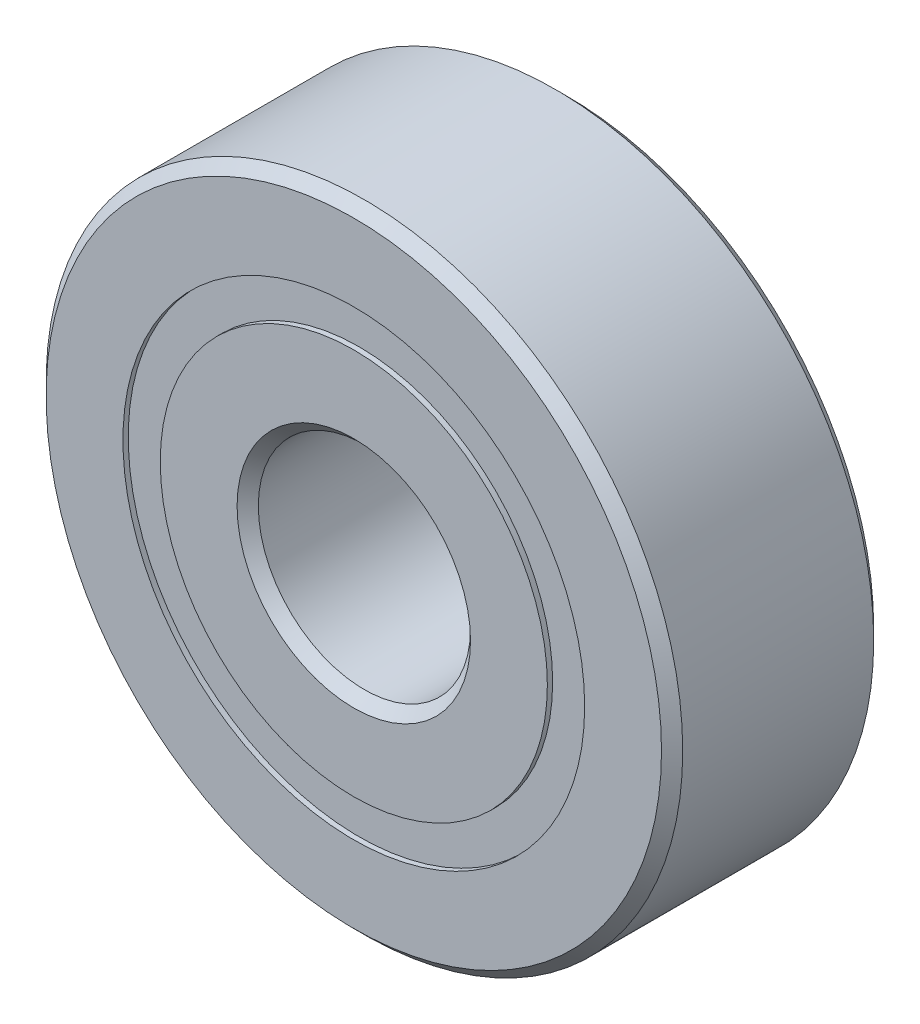
from build123d import *

# Parameters (mm, degrees)
CIRPATTERN1_COUNT = 12
SKETCH5_W         = 0.944081583
SKETCH5_H         = 0.703296704


with BuildPart() as part:
    # Sketch1 → Revolve1 (revolve)
    with BuildSketch(Plane(origin=(0, 0, 0), x_dir=(0, 0, -1), z_dir=(1, 0, 0))):
        with BuildLine():
            Line((1.8, 6), (-1.8, 6))
            Line((-1.8, 6), (-2, 5.8))
            Line((-2, 5.8), (-2, 4.351648352))
            Line((-2, 4.351648352), (-0.888888889, 4.351648352))
            ThreePointArc((-0.888888889, 4.351648352), (0, 4.955918417), (0.888888889, 4.351648352))
            Line((0.888888889, 4.351648352), (2, 4.351648352))
            Line((2, 4.351648352), (2, 5.8))
            Line((2, 5.8), (1.8, 6))
        make_face()
    revolve(axis=Axis((0, 0, 2), (0, 0, -1)))


with BuildPart() as body_2:
    # Sketch3 → Revolve3 (revolve)
    with BuildSketch(Plane(origin=(0, 0, 0), x_dir=(0, 0, -1), z_dir=(1, 0, 0))):
        with BuildLine():
            Line((-2, 3.648351648), (-0.888888889, 3.648351648))
            ThreePointArc((-0.888888889, 3.648351648), (0, 3.044081583), (0.888888889, 3.648351648))
            Line((0.888888889, 3.648351648), (2, 3.648351648))
            Line((2, 3.648351648), (2, 2.2))
            Line((2, 2.2), (1.8, 2))
            Line((1.8, 2), (-1.8, 2))
            Line((-1.8, 2), (-2, 2.2))
            Line((-2, 2.2), (-2, 3.648351648))
        make_face()
    revolve(axis=Axis((0, 0, 2), (0, 0, -1)))


with BuildPart() as body_3:
    # Sketch4 → Revolve4 (revolve)
    with BuildSketch(Plane(origin=(0, 0, 0), x_dir=(0, 0, -1), z_dir=(1, 0, 0))):
        with BuildLine():
            Line((-0.955918417, 4), (0.955918417, 4))
            ThreePointArc((0.955918417, 4), (0, 4.955918417), (-0.955918417, 4))
        make_face()
    revolve(axis=Axis((0, 4, 0.955918417), (0, 0, -1)))


with BuildPart() as cirpattern1_1:
    # CirPattern1: pattern copy
    add(body_3.part.rotate(Axis((0, 0, -2), (0, 0, 1)), 1 * 360 / CIRPATTERN1_COUNT))


with BuildPart() as cirpattern1_2:
    # CirPattern1: pattern copy
    add(body_3.part.rotate(Axis((0, 0, -2), (0, 0, 1)), 2 * 360 / CIRPATTERN1_COUNT))


with BuildPart() as cirpattern1_3:
    # CirPattern1: pattern copy
    add(body_3.part.rotate(Axis((0, 0, -2), (0, 0, 1)), 3 * 360 / CIRPATTERN1_COUNT))


with BuildPart() as cirpattern1_4:
    # CirPattern1: pattern copy
    add(body_3.part.rotate(Axis((0, 0, -2), (0, 0, 1)), 4 * 360 / CIRPATTERN1_COUNT))


with BuildPart() as cirpattern1_5:
    # CirPattern1: pattern copy
    add(body_3.part.rotate(Axis((0, 0, -2), (0, 0, 1)), 5 * 360 / CIRPATTERN1_COUNT))


with BuildPart() as cirpattern1_6:
    # CirPattern1: pattern copy
    add(body_3.part.rotate(Axis((0, 0, -2), (0, 0, 1)), 6 * 360 / CIRPATTERN1_COUNT))


with BuildPart() as cirpattern1_7:
    # CirPattern1: pattern copy
    add(body_3.part.rotate(Axis((0, 0, -2), (0, 0, 1)), 7 * 360 / CIRPATTERN1_COUNT))


with BuildPart() as cirpattern1_8:
    # CirPattern1: pattern copy
    add(body_3.part.rotate(Axis((0, 0, -2), (0, 0, 1)), 8 * 360 / CIRPATTERN1_COUNT))


with BuildPart() as cirpattern1_9:
    # CirPattern1: pattern copy
    add(body_3.part.rotate(Axis((0, 0, -2), (0, 0, 1)), 9 * 360 / CIRPATTERN1_COUNT))


with BuildPart() as cirpattern1_10:
    # CirPattern1: pattern copy
    add(body_3.part.rotate(Axis((0, 0, -2), (0, 0, 1)), 10 * 360 / CIRPATTERN1_COUNT))


with BuildPart() as cirpattern1_11:
    # CirPattern1: pattern copy
    add(body_3.part.rotate(Axis((0, 0, -2), (0, 0, 1)), 11 * 360 / CIRPATTERN1_COUNT))


with BuildPart() as body_15:
    # Sketch5 → Revolve5 (revolve)
    with BuildSketch(Plane(origin=(0, 0, 0), x_dir=(0, 0, -1), z_dir=(1, 0, 0))):
        with Locations((-1.427959209, 4)):
            Rectangle(SKETCH5_W, SKETCH5_H)
        with Locations((1.427959209, 4)):
            Rectangle(SKETCH5_W, SKETCH5_H)
    revolve(axis=Axis((0, 0, 2), (0, 0, -1)))


solid = Compound([part.part, body_2.part, body_3.part, cirpattern1_1.part, cirpattern1_2.part, cirpattern1_3.part, cirpattern1_4.part, cirpattern1_5.part, cirpattern1_6.part, cirpattern1_7.part, cirpattern1_8.part, cirpattern1_9.part, cirpattern1_10.part, cirpattern1_11.part, body_15.part])
